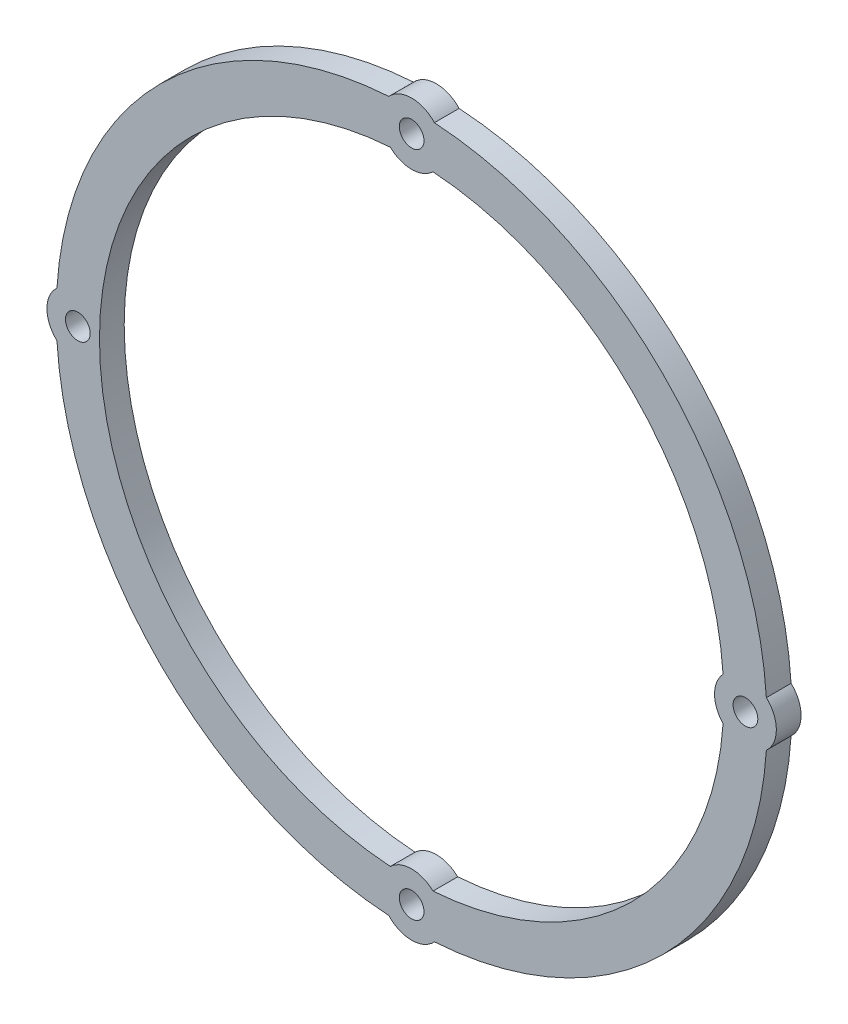
from build123d import *

# Parameters (mm, degrees)
CROQUIS1_R              = 2
SALIENTE_EXTRUIR1_DEPTH = 4


with BuildPart() as part:
    # Croquis1 → Saliente-Extruir1 (new body)
    with BuildSketch(Plane.XY):
        with BuildLine():
            ThreePointArc((57.381944444, -3.682723418), (59, 0), (57.381944444, 3.682723418))
            ThreePointArc((57.381944444, 3.682723418), (40.658639918, 40.658639918), (3.682723418, 57.381944444))
            ThreePointArc((3.682723418, 57.381944444), (0, 59), (-3.682723418, 57.381944444))
            ThreePointArc((-3.682723418, 57.381944444), (-40.658639918, 40.658639918), (-57.381944444, 3.682723418))
            ThreePointArc((-57.381944444, 3.682723418), (-59, 0), (-57.381944444, -3.682723418))
            ThreePointArc((-57.381944444, -3.682723418), (-40.658639918, -40.658639918), (-3.682723418, -57.381944444))
            ThreePointArc((-3.682723418, -57.381944444), (0, -59), (3.682723418, -57.381944444))
            ThreePointArc((3.682723418, -57.381944444), (40.658639918, -40.658639918), (57.381944444, -3.682723418))
        make_face()
        with Locations((54, 0)):
            Circle(CROQUIS1_R, mode=Mode.SUBTRACT)
        with BuildLine():
            ThreePointArc((50.381944444, -3.451039553), (35.70889245, -35.70889245), (3.451039553, -50.381944444))
            ThreePointArc((3.451039553, -50.381944444), (0, -49), (-3.451039553, -50.381944444))
            ThreePointArc((-3.451039553, -50.381944444), (-50.5, 0), (-3.451039553, 50.381944444))
            ThreePointArc((-3.451039553, 50.381944444), (0, 49), (3.451039553, 50.381944444))
            ThreePointArc((3.451039553, 50.381944444), (35.70889245, 35.70889245), (50.381944444, 3.451039553))
            ThreePointArc((50.381944444, 3.451039553), (49, 0), (50.381944444, -3.451039553))
        make_face(mode=Mode.SUBTRACT)
        with Locations((0, -54)):
            Circle(CROQUIS1_R, mode=Mode.SUBTRACT)
        with Locations((0, 54)):
            Circle(CROQUIS1_R, mode=Mode.SUBTRACT)
        with Locations((-54, 0)):
            Circle(CROQUIS1_R, mode=Mode.SUBTRACT)
    extrude(amount=SALIENTE_EXTRUIR1_DEPTH)


solid = part.part
